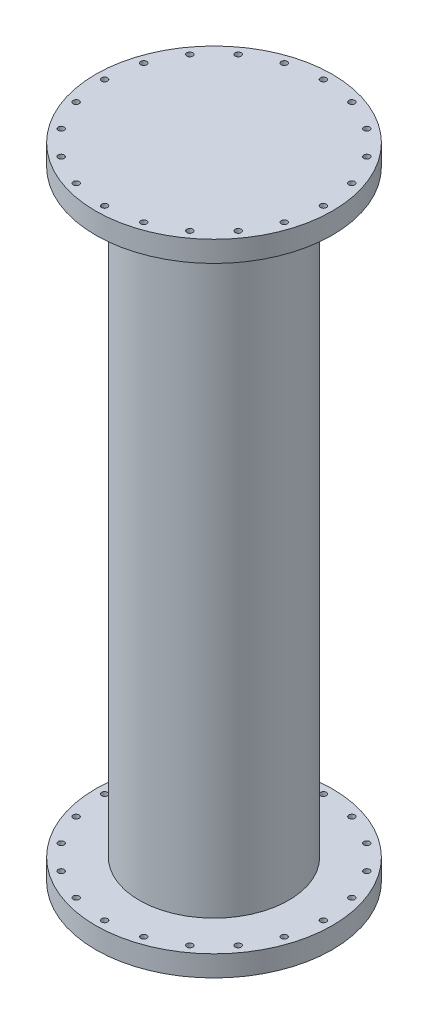
from build123d import *

# Parameters (mm, degrees)
ESQUISSE2_R                  = 10
ENL_V_MAT_EXTRU_1_DEPTH      = 2213.0650985
R_P_TITION_CIRCULAIRE1_COUNT = 20
ESQUISSE4_R                  = 10
ENL_V_MAT_EXTRU_2_DEPTH      = 50
R_P_TITION_CIRCULAIRE2_COUNT = 12


with BuildPart() as part:
    # Esquisse1 → Révolution1 (revolve)
    with BuildSketch(Plane.XY, mode=Mode.PRIVATE) as r_volution1_sk:
        Polygon((0, 0), (396, 0), (396, -70), (250, -70), (250, -2070), (396, -2070), (396, -2140), (0, -2140), (0, -2070), (200, -2070), (200, -70), (0, -70), align=None)
    revolve(r_volution1_sk.sketch.rotate(Axis((0, 0, 0), (0, -1, 0)), 180), axis=Axis((0, 0, 0), (0, -1, 0)))

    # Esquisse2 → Enlèv. mat.-Extru.1 (cut, through all)
    with BuildSketch(Plane(origin=(0, 0, 0), x_dir=(1, 0, 0), z_dir=(0, 1, 0))):
        with Locations(Location((366, 0, 0), (0, 0, 180))):
            Circle(ESQUISSE2_R)
    enl_v_mat_extru_1 = extrude(amount=-ENL_V_MAT_EXTRU_1_DEPTH, mode=Mode.SUBTRACT)

    # Répétition circulaire1: Enlèv. mat.-Extru.1 ×20 about axis
    r_p_tition_circulaire1_axis = Axis((0, 0, 0), (0, 1, 0))
    for i in range(1, R_P_TITION_CIRCULAIRE1_COUNT):
        add(enl_v_mat_extru_1.rotate(r_p_tition_circulaire1_axis, i * 360 / R_P_TITION_CIRCULAIRE1_COUNT), mode=Mode.SUBTRACT)

    # Esquisse4 → Enlèv. mat.-Extru.2 (cut)
    with BuildSketch(Plane.XZ.offset(2140)):
        with Locations(Location((0, 230.819920557, 0), (0, 0, 270))):
            Circle(ESQUISSE4_R)
    enl_v_mat_extru_2 = extrude(amount=-ENL_V_MAT_EXTRU_2_DEPTH, mode=Mode.SUBTRACT)

    # Répétition circulaire2: Enlèv. mat.-Extru.2 ×12 about axis
    r_p_tition_circulaire2_axis = Axis((0, 0, 0), (0, 1, 0))
    for i in range(1, R_P_TITION_CIRCULAIRE2_COUNT):
        add(enl_v_mat_extru_2.rotate(r_p_tition_circulaire2_axis, i * 360 / R_P_TITION_CIRCULAIRE2_COUNT), mode=Mode.SUBTRACT)


with BuildPart() as body_2:
    # Fractionner1: the piece on the far side of the plane
    add(part.part)
    split(bisect_by=Plane(origin=(0, -2070, 0), x_dir=(-1, 0, 0), z_dir=(0, -1, 0)), keep=Keep.BOTTOM)


with BuildPart() as part_1:
    add(part.part)

    # Fractionner1
    split(bisect_by=Plane(origin=(0, -2070, 0), x_dir=(-1, 0, 0), z_dir=(0, -1, 0)), keep=Keep.TOP)


solid = Compound([body_2.part, part_1.part])
